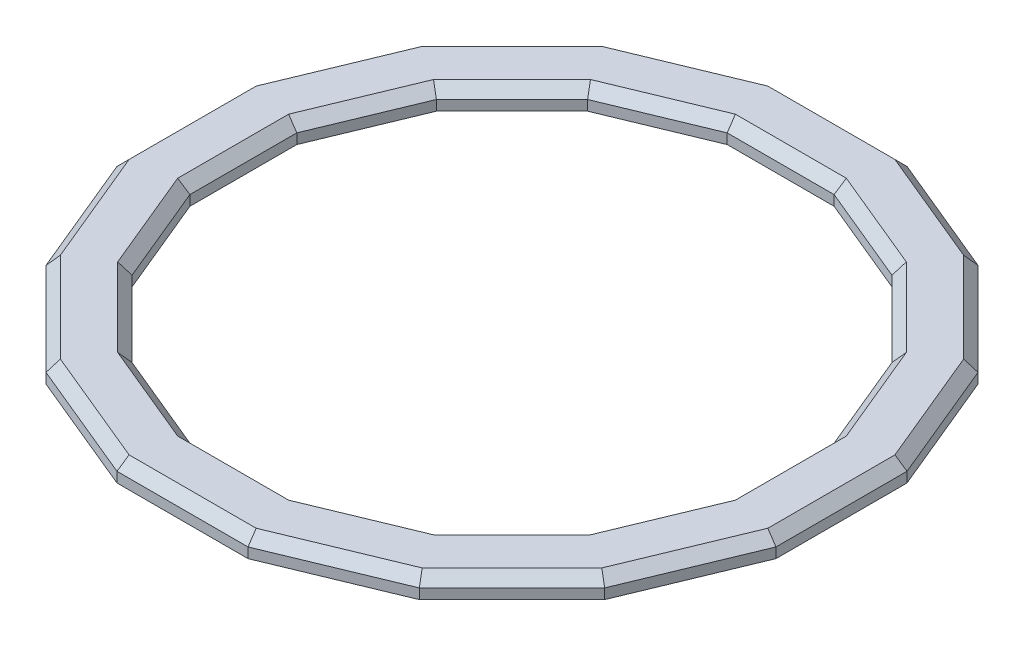
from build123d import *

# Parameters (mm, degrees)
BOSS_EXTRUDE1_DEPTH = 4
CHAMFER1_SIZE       = 2
SHELL1_T            = -2


with BuildPart() as part:
    # Sketch1 → Boss-Extrude1 (new body)
    with BuildSketch(Plane(origin=(0, 0, 0), x_dir=(1, 0, 0), z_dir=(0, 1, 0))):
        Polygon((36.819542328, 55.104339226), (12.92930388, 65), (-12.92930388, 65), (-36.819542328, 55.104339226), (-55.104339226, 36.819542328), (-65, 12.92930388), (-65, -12.92930388), (-55.104339226, -36.819542328), (-36.819542328, -55.104339226), (-12.92930388, -65), (12.92930388, -65), (36.819542328, -55.104339226), (55.104339226, -36.819542328), (65, -12.92930388), (65, 12.92930388), (55.104339226, 36.819542328), align=None)
        Polygon((10.542355471, 53), (-10.542355471, 53), (-30.02208836, 44.931230446), (-44.931230446, 30.02208836), (-53, 10.542355471), (-53, -10.542355471), (-44.931230446, -30.02208836), (-30.02208836, -44.931230446), (-10.542355471, -53), (10.542355471, -53), (30.02208836, -44.931230446), (44.931230446, -30.02208836), (53, -10.542355471), (53, 10.542355471), (44.931230446, 30.02208836), (30.02208836, 44.931230446), align=None, mode=Mode.SUBTRACT)
    extrude(amount=BOSS_EXTRUDE1_DEPTH)

    # Chamfer1
    chamfer1_edges = [part.edges().sort_by_distance(p)[0] for p in [
        (0, 4, -65),
        (-24.874423104, 4, -60.052169613),
        (-45.961940777, 4, -45.961940777),
        (-60.052169613, 4, -24.874423104),
        (-65, 4, 0),
        (-60.052169613, 4, 24.874423104),
        (-45.961940777, 4, 45.961940777),
        (-24.874423104, 4, 60.052169613),
        (0, 4, 65),
        (24.874423104, 4, 60.052169613),
        (45.961940777, 4, -45.961940777),
        (45.961940777, 4, 45.961940777),
        (60.052169613, 4, 24.874423104),
        (20.282221915, 4, -48.965615223),
        (0, 4, -53),
        (-20.282221915, 4, -48.965615223),
        (-37.476659403, 4, -37.476659403),
        (-48.965615223, 4, -20.282221915),
        (-53, 4, 0),
        (-48.965615223, 4, 20.282221915),
        (65, 4, 0),
        (-37.476659403, 4, 37.476659403),
        (-20.282221915, 4, 48.965615223),
        (0, 4, 53),
        (20.282221915, 4, 48.965615223),
        (37.476659403, 4, 37.476659403),
        (48.965615223, 4, 20.282221915),
        (53, 4, 0),
        (48.965615223, 4, -20.282221915),
        (37.476659403, 4, -37.476659403),
        (60.052169613, 4, -24.874423104),
        (24.874423104, 4, -60.052169613),
    ]]
    chamfer(chamfer1_edges, length=CHAMFER1_SIZE)

    # Shell1
    shell1_openings = [part.faces().sort_by_distance(p)[0] for p in [
        (24.170868174, 0, -58.353637759),
    ]]
    offset(amount=SHELL1_T, openings=shell1_openings, kind=Kind.INTERSECTION)


solid = part.part
